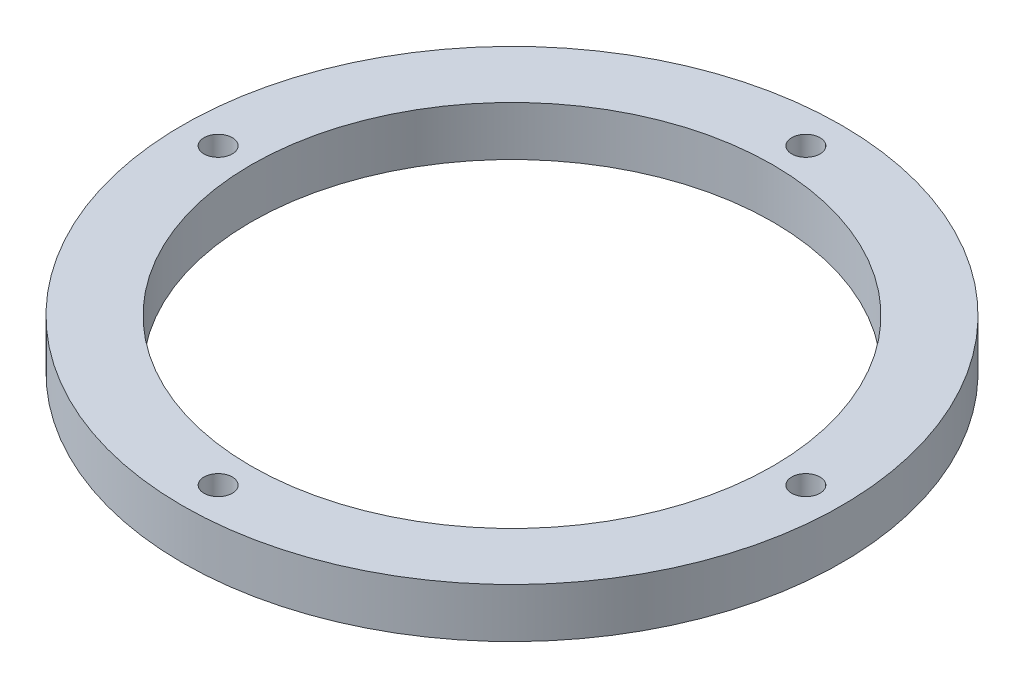
from build123d import *

# Parameters (mm, degrees)
SKETCH_1_R          = 60
SKETCH_1_R_2        = 47.5
EXTRUDE_1_DEPTH     = 9
CUT_EXTRUDE_1_REACH = 87.329
SKETCH_2_R          = 2.575


with BuildPart() as part:
    # 草图1 → 凸台-拉伸1 (new body)
    with BuildSketch(Plane(origin=(0, 0, 0), x_dir=(1, 0, 0), z_dir=(0, 1, 0))):
        with Locations(Location((0, 0, 0), (0, 0, 270))):
            Circle(SKETCH_1_R)
        with Locations(Location((0, 0, 0), (0, 0, 270))):
            Circle(SKETCH_1_R_2, mode=Mode.SUBTRACT)
    extrude(amount=EXTRUDE_1_DEPTH)

    # 草图2 → 切除-拉伸1 (cut, up to next)
    with BuildSketch(Plane(origin=(0, 9, 0), x_dir=(1, 0, 0), z_dir=(0, 1, 0)), mode=Mode.PRIVATE) as cut_extrude_1_sk1:
        with Locations(Location((0, 53.5, 0), (0, 0, 270))):
            Circle(SKETCH_2_R)
    cut_extrude_1_tool1 = extrude(cut_extrude_1_sk1.sketch, amount=-CUT_EXTRUDE_1_REACH, mode=Mode.PRIVATE) & part.part
    # 草图2 → 切除-拉伸1 (cut, up to next)
    with BuildSketch(Plane(origin=(0, 9, 0), x_dir=(1, 0, 0), z_dir=(0, 1, 0)), mode=Mode.PRIVATE) as cut_extrude_1_sk2:
        with Locations(Location((53.5, 0, 0), (0, 0, 270))):
            Circle(SKETCH_2_R)
    cut_extrude_1_tool2 = extrude(cut_extrude_1_sk2.sketch, amount=-CUT_EXTRUDE_1_REACH, mode=Mode.PRIVATE) & part.part
    # 草图2 → 切除-拉伸1 (cut, up to next)
    with BuildSketch(Plane(origin=(0, 9, 0), x_dir=(1, 0, 0), z_dir=(0, 1, 0)), mode=Mode.PRIVATE) as cut_extrude_1_sk3:
        with Locations(Location((0, -53.5, 0), (0, 0, 270))):
            Circle(SKETCH_2_R)
    cut_extrude_1_tool3 = extrude(cut_extrude_1_sk3.sketch, amount=-CUT_EXTRUDE_1_REACH, mode=Mode.PRIVATE) & part.part
    # 草图2 → 切除-拉伸1 (cut, up to next)
    with BuildSketch(Plane(origin=(0, 9, 0), x_dir=(1, 0, 0), z_dir=(0, 1, 0)), mode=Mode.PRIVATE) as cut_extrude_1_sk4:
        with Locations(Location((-53.5, 0, 0), (0, 0, 270))):
            Circle(SKETCH_2_R)
    cut_extrude_1_tool4 = extrude(cut_extrude_1_sk4.sketch, amount=-CUT_EXTRUDE_1_REACH, mode=Mode.PRIVATE) & part.part
    add(cut_extrude_1_tool1.solids().sort_by_distance((0, 9, -53.5))[0], mode=Mode.SUBTRACT)
    add(cut_extrude_1_tool2.solids().sort_by_distance((53.5, 9, 0))[0], mode=Mode.SUBTRACT)
    add(cut_extrude_1_tool3.solids().sort_by_distance((0, 9, 53.5))[0], mode=Mode.SUBTRACT)
    add(cut_extrude_1_tool4.solids().sort_by_distance((-53.5, 9, 0))[0], mode=Mode.SUBTRACT)


solid = part.part
